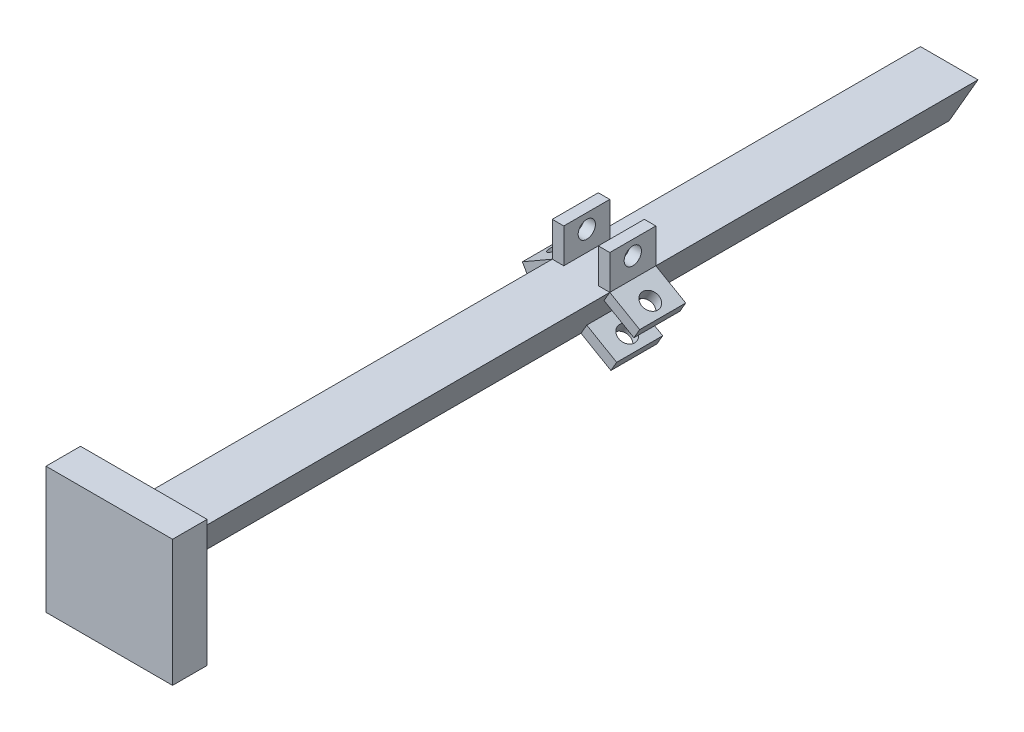
from build123d import *

# Parameters (mm, degrees)
BOSS_EXTRU_1_DEPTH      = 70
ESQUISSE3_W             = 1
ESQUISSE3_H             = 4
BOSS_EXTRU_2_DEPTH      = 3
ESQUISSE4_W             = 1
ESQUISSE4_H             = 4
BOSS_EXTRU_3_DEPTH      = 3
ESQUISSE6_R             = 0.75
ENL_V_MAT_EXTRU_1_DEPTH = 5
ESQUISSE7_W             = 4
ESQUISSE7_H             = 1
BOSS_EXTRU_4_DEPTH      = 3
ESQUISSE8_W             = 4
ESQUISSE8_H             = 1
BOSS_EXTRU_5_DEPTH      = 3
ESQUISSE9_R             = 0.75
ENL_V_MAT_EXTRU_2_DEPTH = 5.1
ESQUISSE10_W            = 4
ESQUISSE10_H            = 1
BOSS_EXTRU_6_DEPTH      = 3
ESQUISSE11_W            = 4
ESQUISSE11_H            = 1
BOSS_EXTRU_7_DEPTH      = 3
ESQUISSE12_R            = 0.75
ENL_V_MAT_EXTRU_3_DEPTH = 5.1
ESQUISSE13_W            = 11
ESQUISSE13_H            = 11
BOSS_EXTRU_8_DEPTH      = 3


with BuildPart() as part:
    # Esquisse1 → Boss.-Extru.1 (new body)
    with BuildSketch(Plane.XY):
        Polygon((-1.402144657, 1.200833509), (1.095290548, -3.130773283), (3.597855343, 1.200833509), align=None)
    extrude(amount=BOSS_EXTRU_1_DEPTH)

    # Esquisse3 → Boss.-Extru.2 (add)
    with BuildSketch(Plane(origin=(0, 1.200833509, 0), x_dir=(1, 0, 0), z_dir=(0, 1, 0))):
        with Locations((-0.902144657, -30)):
            Rectangle(ESQUISSE3_W, ESQUISSE3_H)
    extrude(amount=BOSS_EXTRU_2_DEPTH)

    # Esquisse4 → Boss.-Extru.3 (add)
    with BuildSketch(Plane(origin=(0, 1.200833509, 0), x_dir=(1, 0, 0), z_dir=(0, 1, 0))):
        with Locations((3.097855343, -30)):
            Rectangle(ESQUISSE4_W, ESQUISSE4_H)
    extrude(amount=BOSS_EXTRU_3_DEPTH)

    # Esquisse6 → Enlèv. mat.-Extru.1 (cut)
    with BuildSketch(Plane(origin=(3.597855343, 0, 0), x_dir=(0, 0, -1), z_dir=(1, 0, 0))):
        with Locations(Location((-30, 2.950833509, 0), (0, 0, 90))):
            Circle(ESQUISSE6_R)
    extrude(amount=-ENL_V_MAT_EXTRU_1_DEPTH, mode=Mode.SUBTRACT)

    # Esquisse7 → Boss.-Extru.4 (add)
    with BuildSketch(Plane(origin=(2.177314873, -1.257933098, 0), x_dir=(0, 0, -1), z_dir=(0.8658773126093765, -0.5002564137603478, 0))):
        with Locations((-29.999890103, 2.339624703)):
            Rectangle(ESQUISSE7_W, ESQUISSE7_H)
    extrude(amount=BOSS_EXTRU_4_DEPTH)

    # Esquisse8 → Boss.-Extru.5 (add)
    with BuildSketch(Plane(origin=(2.177314873, -1.257933098, 0), x_dir=(0, 0, -1), z_dir=(0.8658773126093764, -0.5002564137603477, 0))):
        with Locations((-29.999890103, -1.662939435)):
            Rectangle(ESQUISSE8_W, ESQUISSE8_H)
    extrude(amount=BOSS_EXTRU_5_DEPTH)

    # Esquisse9 → Enlèv. mat.-Extru.2 (cut)
    with BuildSketch(Plane(origin=(-1.082024325, -1.872840185, 0), x_dir=(-0.8658773126093765, 0.5002564137603478, 0), z_dir=(-0.5002564137603477, -0.8658773126093764, 0))):
        with Locations(Location((-4.264576651, -29.999890103, 0), (0, 0, 180))):
            Circle(ESQUISSE9_R)
    extrude(amount=-ENL_V_MAT_EXTRU_2_DEPTH, mode=Mode.SUBTRACT)

    # Esquisse10 → Boss.-Extru.6 (add)
    with BuildSketch(Plane(origin=(-0.532707143, -0.307138122, 0), x_dir=(0, 0, 1), z_dir=(-0.8663213583248282, -0.499487040983272, 0))):
        with Locations((29.999890103, -2.759339198)):
            Rectangle(ESQUISSE10_W, ESQUISSE10_H)
    extrude(amount=BOSS_EXTRU_6_DEPTH)

    # Esquisse11 → Boss.-Extru.7 (add)
    with BuildSketch(Plane(origin=(-0.532707143, -0.307138122, 0), x_dir=(0, 0, 1), z_dir=(-0.8663213583248282, -0.499487040983272, 0))):
        with Locations((30, 1.240660802)):
            Rectangle(ESQUISSE11_W, ESQUISSE11_H)
    extrude(amount=BOSS_EXTRU_7_DEPTH)

    # Esquisse12 → Enlèv. mat.-Extru.3 (cut)
    with BuildSketch(Plane(origin=(-0.869437513, 1.50797163, 0), x_dir=(0.866321358324828, 0.499487040983272, 0), z_dir=(-0.499487040983272, 0.866321358324828, 0))):
        with Locations(Location((-2.364907088, -30, 0), (0, 0, 180))):
            Circle(ESQUISSE12_R)
    extrude(amount=-ENL_V_MAT_EXTRU_3_DEPTH, mode=Mode.SUBTRACT)

    # Esquisse13 → Boss.-Extru.8 (add)
    with BuildSketch(Plane.XY.offset(70)):
        with Locations((1.097855343, -0.880773283)):
            Rectangle(ESQUISSE13_W, ESQUISSE13_H)
    extrude(amount=BOSS_EXTRU_8_DEPTH)


solid = part.part
